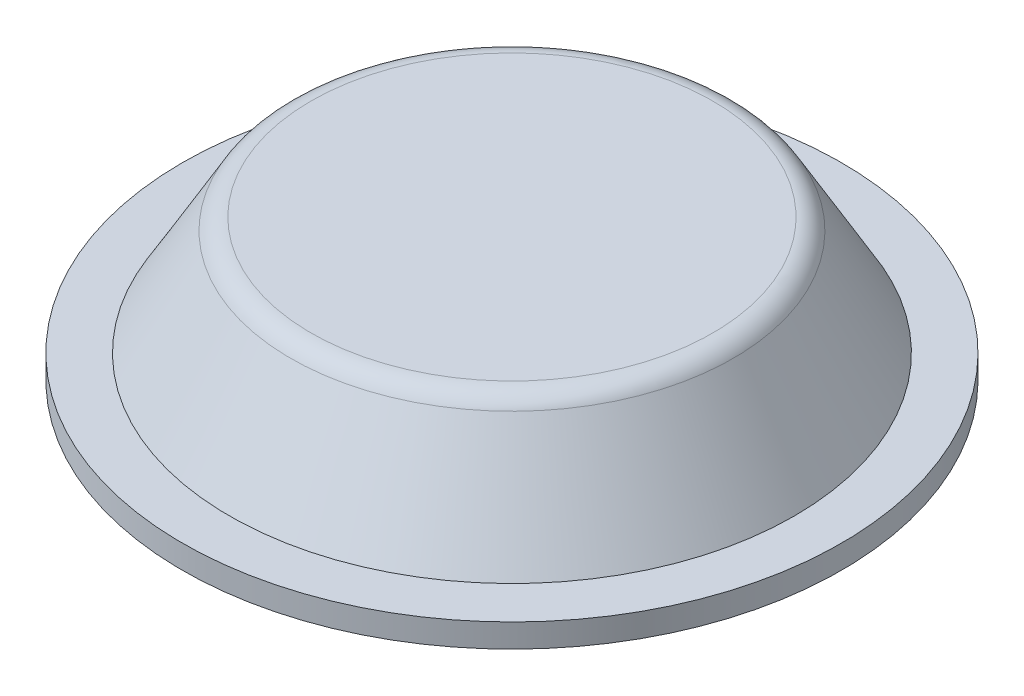
from build123d import *


with BuildPart() as part:
    # Sketch1 → Revolve1 (revolve)
    with BuildSketch(Plane.XY):
        with BuildLine():
            Line((-35.56, 0), (-35.56, 2.54))
            Line((-35.56, 2.54), (-30.48, 2.54))
            Line((-30.48, 2.54), (-23.880886423, 13.97))
            ThreePointArc((-23.880886423, 13.97), (-22.951181898, 14.899704526), (-21.681181898, 15.24))
            Line((-21.681181898, 15.24), (0, 15.24))
            Line((0, 15.24), (0, 3.81))
            Line((0, 3.81), (-2.54, 3.81))
            Line((-2.54, 3.81), (-2.54, 12.7))
            Line((-2.54, 12.7), (-21.681181898, 12.7))
            Line((-21.681181898, 12.7), (-29.013530316, 0))
            Line((-29.013530316, 0), (-35.56, 0))
        make_face()
    revolve(axis=Axis((0, 15.24, 0), (0, -1, 0)))


solid = part.part
